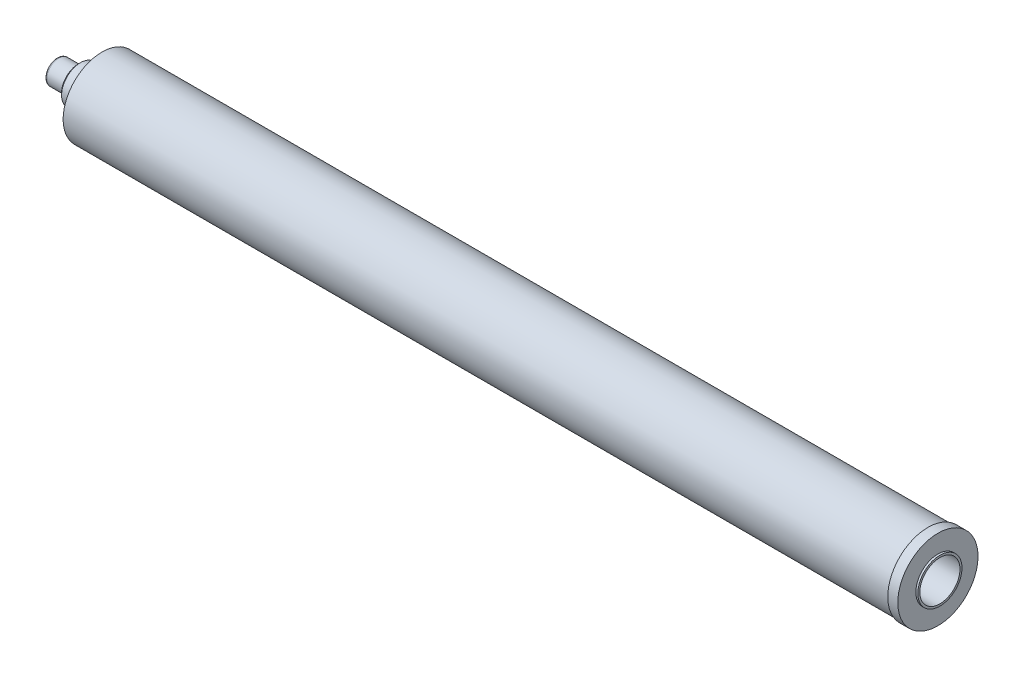
from build123d import *

# Parameters (mm, degrees)
CSK_FOR_3_8_FLAT_HEAD_MACHINE_SCREW_100_D           = 10.0838
CSK_FOR_3_8_FLAT_HEAD_MACHINE_SCREW_100_DEPTH       = 25.4
CSK_FOR_3_8_FLAT_HEAD_MACHINE_SCREW_100_CSINK_D     = 19.3548
CSK_FOR_3_8_FLAT_HEAD_MACHINE_SCREW_100_CSINK_ANGLE = 100
CSK_FOR_3_8_FLAT_HEAD_MACHINE_SCREW_100_TIP         = 3.029479155
FILLET1_R                                           = 2.54
CHAMFER1_SIZE                                       = 2.54
SKETCH4_R                                           = 27.94
SKETCH4_R_2                                         = 25.4
BOSS_EXTRUDE1_DEPTH                                 = 2.54
CUT_EXTRUDE1_START                                  = -508
SKETCH5_R                                           = 25.4
CUT_EXTRUDE1_DEPTH                                  = 508


with BuildPart() as part:
    # Sketch1 → Revolve1 (revolve)
    with BuildSketch(Plane.XY):
        Polygon((0, 0), (0, 15.24), (27.305, 15.24), (27.305, 23.876), (57.15, 23.876), (57.15, 49.2125), (1103.122, 49.2125), (1103.122, 50.8), (1115.822, 50.8), (1115.822, 0), align=None)
    revolve(axis=Axis((1115.822, 0, 0), (-1, 0, 0)))

    # CSK for 3/8 Flat Head Machine Screw (100)1
    with Locations(Plane.ZY):
        with Locations((0, 0)):
            CounterSinkHole(CSK_FOR_3_8_FLAT_HEAD_MACHINE_SCREW_100_D / 2, CSK_FOR_3_8_FLAT_HEAD_MACHINE_SCREW_100_CSINK_D / 2, depth=CSK_FOR_3_8_FLAT_HEAD_MACHINE_SCREW_100_DEPTH, counter_sink_angle=CSK_FOR_3_8_FLAT_HEAD_MACHINE_SCREW_100_CSINK_ANGLE)
            with Locations((0, 0, -(CSK_FOR_3_8_FLAT_HEAD_MACHINE_SCREW_100_DEPTH + CSK_FOR_3_8_FLAT_HEAD_MACHINE_SCREW_100_TIP / 2))):  # 118° drill point
                Cone(0, CSK_FOR_3_8_FLAT_HEAD_MACHINE_SCREW_100_D / 2, CSK_FOR_3_8_FLAT_HEAD_MACHINE_SCREW_100_TIP, mode=Mode.SUBTRACT)

    # Fillet1
    fillet1_edges = [part.edges().sort_by_distance(p)[0] for p in [
        (0, -15.24, 0),
    ]]
    fillet(fillet1_edges, radius=FILLET1_R)

    # Chamfer1
    chamfer1_edges = [part.edges().sort_by_distance(p)[0] for p in [
        (27.305, -23.876, 0),
    ]]
    chamfer(chamfer1_edges, length=CHAMFER1_SIZE)

    # Sketch4 → Boss-Extrude1 (add)
    with BuildSketch(Plane(origin=(1115.822, 0, 0), x_dir=(0, 0, -1), z_dir=(1, 0, 0))):
        with Locations(Location((0, 0, 0), (0, 0, 90))):
            Circle(SKETCH4_R)
        with Locations(Location((0, 0, 0), (0, 0, 90))):
            Circle(SKETCH4_R_2, mode=Mode.SUBTRACT)
    extrude(amount=BOSS_EXTRUDE1_DEPTH)

    # Sketch5 → Cut-Extrude1 (cut)
    with BuildSketch(Plane(origin=(1118.362, 0, 0), x_dir=(0, 0, -1), z_dir=(1, 0, 0)).offset(CUT_EXTRUDE1_START)):
        with Locations(Location((0, 0, 0), (0, 0, 90))):
            Circle(SKETCH5_R)
    extrude(amount=CUT_EXTRUDE1_DEPTH, mode=Mode.SUBTRACT)


solid = part.part
